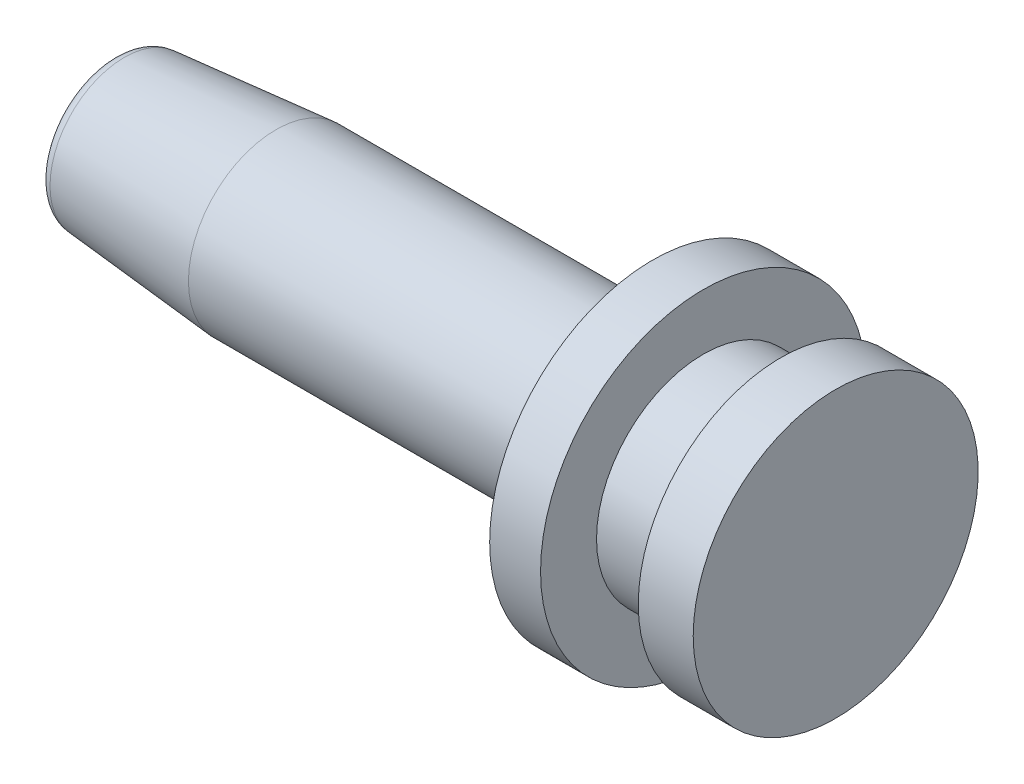
from build123d import *

# Parameters (mm, degrees)
FILETE1_R = 0.6


with BuildPart() as part:
    # Esboço1 → Revolução1 (revolve)
    with BuildSketch(Plane.XY, mode=Mode.PRIVATE) as revolu_o1_sk:
        Polygon((35.5, 0), (35.5, 7), (32.8, 7), (32.8, 5.25), (29, 5.25), (29, 8), (26.5, 8), (24, 4.3), (8, 4.3), (0, 3.6), (0, 0), align=None)
    revolve(revolu_o1_sk.sketch.rotate(Axis((0, 0, 0), (1, 0, 0)), 90), axis=Axis((0, 0, 0), (1, 0, 0)))

    # Filete1
    filete1_edges = [part.edges().sort_by_distance(p)[0] for p in [
        (0, 0, -3.6),
    ]]
    fillet(filete1_edges, radius=FILETE1_R)


solid = part.part
